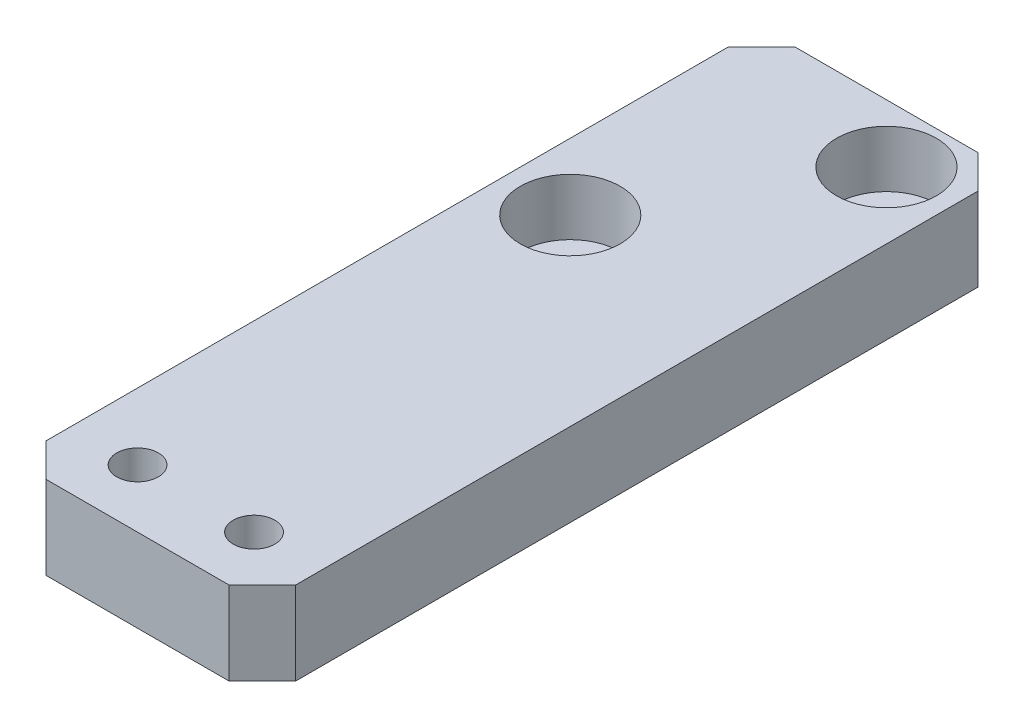
from build123d import *

# Parameters (mm, degrees)
SKETCH1_W                                            = 15
SKETCH1_H                                            = 45
BOSS_EXTRUDE1_DEPTH                                  = 5
M3_TAPPED_HOLE1_D                                    = 2.5
M3_TAPPED_HOLE1_DEPTH                                = 4
M3_TAPPED_HOLE1_TIP                                  = 0.751075774
CBORE_FOR_M3_HEXAGON_SOCKET_HEAD_CAP_SCR_D           = 3.4
CBORE_FOR_M3_HEXAGON_SOCKET_HEAD_CAP_SCR_CBORE_D     = 6
CBORE_FOR_M3_HEXAGON_SOCKET_HEAD_CAP_SCR_CBORE_DEPTH = 3.4
CHAMFER1_SIZE                                        = 2


with BuildPart() as part:
    # Sketch1 → Boss-Extrude1 (new body)
    with BuildSketch(Plane(origin=(0, 0, 0), x_dir=(1, 0, 0), z_dir=(0, 1, 0))):
        Rectangle(SKETCH1_W, SKETCH1_H)
    extrude(amount=BOSS_EXTRUDE1_DEPTH)

    # M3 Tapped Hole1
    with Locations(Plane(origin=(0, 5, 0), x_dir=(1, 0, 0), z_dir=(0, 1, 0))):
        with Locations((-3.5, -19), (3.5, -19)):
            Hole(M3_TAPPED_HOLE1_D / 2, depth=M3_TAPPED_HOLE1_DEPTH)
            with Locations((0, 0, -(M3_TAPPED_HOLE1_DEPTH + M3_TAPPED_HOLE1_TIP / 2))):  # 118° drill point
                Cone(0, M3_TAPPED_HOLE1_D / 2, M3_TAPPED_HOLE1_TIP, mode=Mode.SUBTRACT)

    # CBORE for M3 Hexagon socket head cap screws1 (through all)
    with Locations(Plane(origin=(0, 5, 0), x_dir=(1, 0, 0), z_dir=(0, 1, 0))):
        with Locations((3.5, 19), (-3.5, 7)):
            CounterBoreHole(CBORE_FOR_M3_HEXAGON_SOCKET_HEAD_CAP_SCR_D / 2, CBORE_FOR_M3_HEXAGON_SOCKET_HEAD_CAP_SCR_CBORE_D / 2, CBORE_FOR_M3_HEXAGON_SOCKET_HEAD_CAP_SCR_CBORE_DEPTH)

    # Chamfer1
    chamfer1_edges = [part.edges().sort_by_distance(p)[0] for p in [
        (7.5, 2.5, 22.5),
        (-7.5, 2.5, 22.5),
        (-7.5, 2.5, -22.5),
        (7.5, 2.5, -22.5),
    ]]
    chamfer(chamfer1_edges, length=CHAMFER1_SIZE)


solid = part.part
